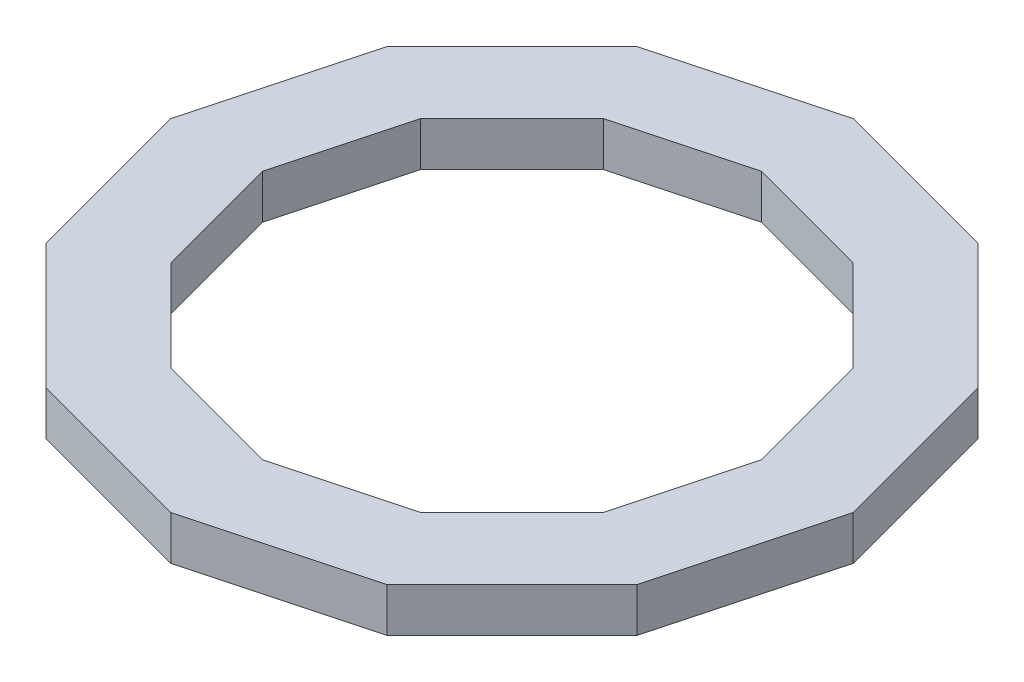
from build123d import *

# Parameters (mm, degrees)
BOSS_EXTRUDE2_DEPTH = 19.05


with BuildPart() as part:
    # Sketch2 → Boss-Extrude2 (new body)
    with BuildSketch(Plane(origin=(0, 0, 0), x_dir=(1, 0, 0), z_dir=(0, 1, 0))):
        Polygon((-147.207095926, 0), (-127.48508469, -73.603547963), (-73.603547963, -127.48508469), (0, -147.207095926), (73.603547963, -127.48508469), (127.48508469, -73.603547963), (147.207095926, 0), (127.48508469, 73.603547963), (73.603547963, 127.48508469), (0, 147.207095926), (-73.603547963, 127.48508469), (-127.48508469, 73.603547963), align=None)
        Polygon((-107.763073453, 0), (-93.3255592, -53.881536726), (-53.881536726, -93.3255592), (0, -107.763073453), (53.881536726, -93.3255592), (93.3255592, -53.881536726), (107.763073453, 0), (93.3255592, 53.881536726), (53.881536726, 93.3255592), (0, 107.763073453), (-53.881536726, 93.3255592), (-93.3255592, 53.881536726), align=None, mode=Mode.SUBTRACT)
    extrude(amount=BOSS_EXTRUDE2_DEPTH)


solid = part.part
